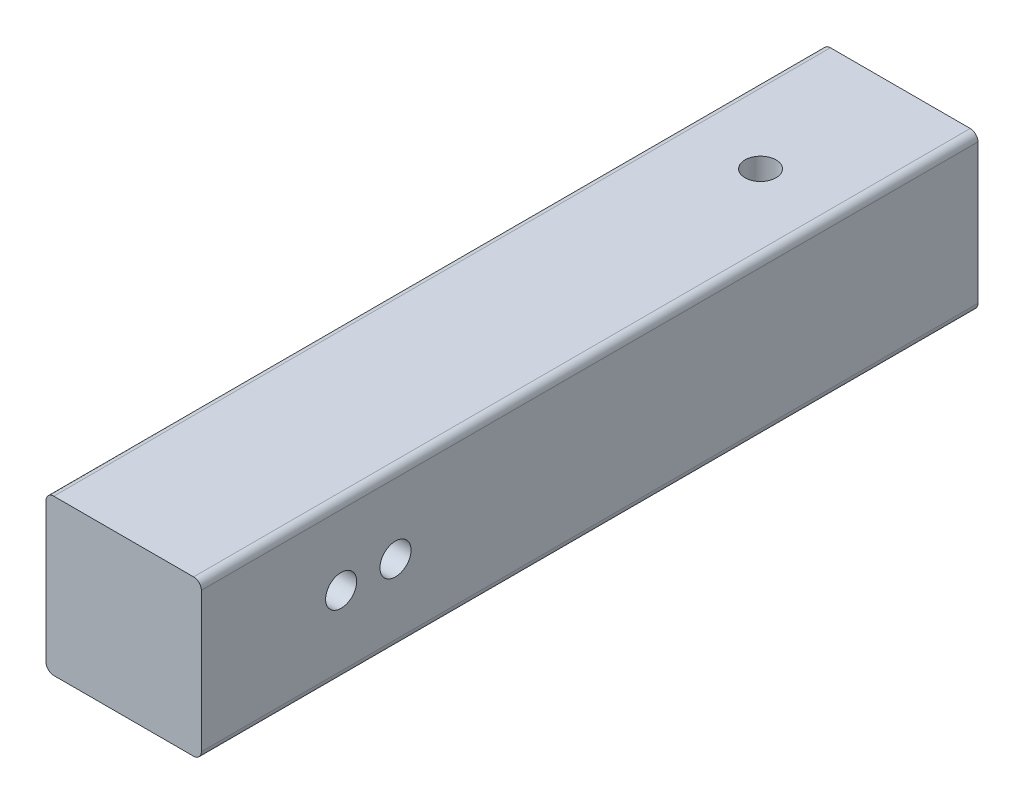
from build123d import *

# Parameters (mm, degrees)
SKETCH_1_W          = 20
SKETCH_1_H          = 20
EXTRUDE_1_DEPTH     = 100
FILLET_1_R          = 1
SKETCH_2_R          = 2
CUT_EXTRUDE_1_DEPTH = 110
SKETCH_3_R          = 2
CUT_EXTRUDE_2_DEPTH = 110
SKETCH_4_R          = 2
CUT_EXTRUDE_3_DEPTH = 20


with BuildPart() as part:
    # 草图1 → 凸台-拉伸1 (new body)
    with BuildSketch(Plane.XY):
        with Locations((10, 10)):
            Rectangle(SKETCH_1_W, SKETCH_1_H)
    extrude(amount=EXTRUDE_1_DEPTH)

    # 圆角1
    fillet_1_edges = [part.edges().sort_by_distance(p)[0] for p in [
        (0, 20, 50),
        (20, 20, 50),
        (20, 0, 50),
        (0, 0, 50),
    ]]
    fillet(fillet_1_edges, radius=FILLET_1_R)

    # 草图2 → 切除-拉伸1 (cut)
    with BuildSketch(Plane.ZY):
        with Locations((82, 10)):
            Circle(SKETCH_2_R)
    extrude(amount=-CUT_EXTRUDE_1_DEPTH, mode=Mode.SUBTRACT)

    # 草图3 → 切除-拉伸2 (cut)
    with BuildSketch(Plane(origin=(0, 20, 0), x_dir=(1, 0, 0), z_dir=(0, 1, 0))):
        with Locations(Location((10, -18, 0), (0, 0, 270))):
            Circle(SKETCH_3_R)
    extrude(amount=-CUT_EXTRUDE_2_DEPTH, mode=Mode.SUBTRACT)

    # 草图4 → 切除-拉伸3 (cut)
    with BuildSketch(Plane(origin=(20, 0, 0), x_dir=(0, 0, -1), z_dir=(1, 0, 0))):
        with Locations((-75, 10)):
            Circle(SKETCH_4_R)
    extrude(amount=-CUT_EXTRUDE_3_DEPTH, mode=Mode.SUBTRACT)


solid = part.part
